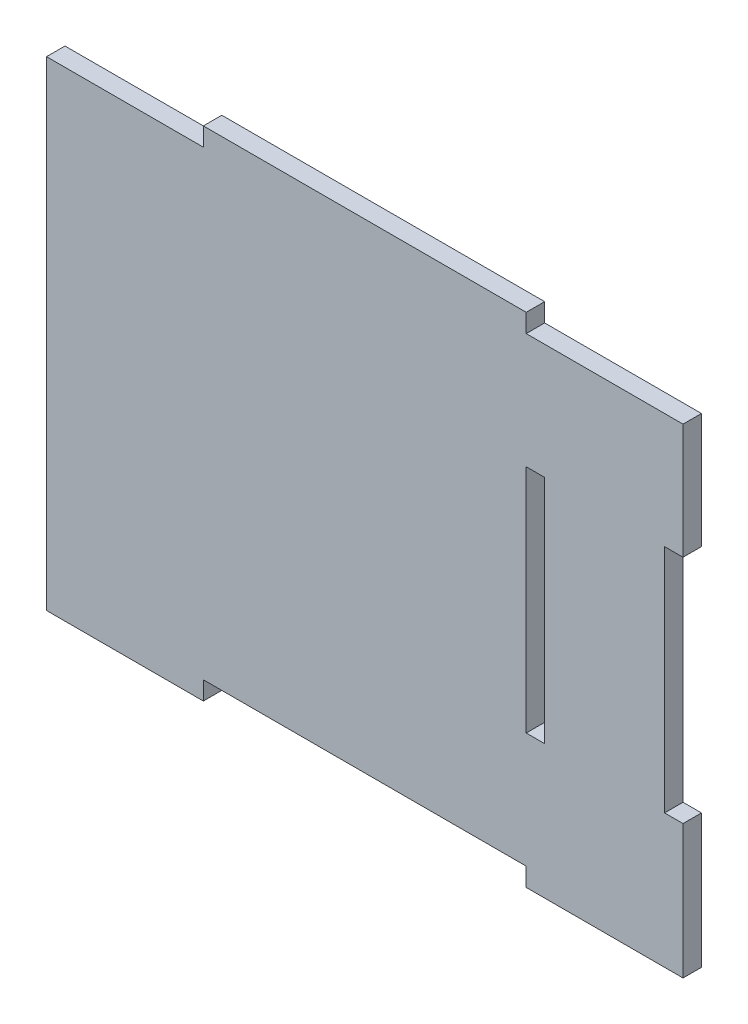
from build123d import *

# Parameters (mm, degrees)
SKETCH_1_W      = 4
SKETCH_1_H      = 50
EXTRUDE_1_DEPTH = 4


with BuildPart() as part:
    # Эскиз1 → Бобышка-Вытянуть1 (new body)
    with BuildSketch(Plane.XY):
        Polygon((-35.380363478, 50.607363696), (-65.380363478, 50.607363696), (-69.380363478, 50.607363696), (-69.380363478, -53.392636304), (-65.380363478, -53.392636304), (-35.380363478, -53.392636304), (-35.380363478, -49.392636304), (34.619636522, -49.392636304), (34.619636522, -53.392636304), (64.619636522, -53.392636304), (68.619636522, -53.392636304), (68.619636522, -24.392636304), (64.619636522, -24.392636304), (64.619636522, 25.607363696), (68.619636522, 25.607363696), (68.619636522, 50.607363696), (64.619636522, 50.607363696), (34.619636522, 50.607363696), (34.619636522, 54.607363696), (-35.380363478, 54.607363696), align=None)
        with Locations((36.619636522, 0.607363696)):
            Rectangle(SKETCH_1_W, SKETCH_1_H, mode=Mode.SUBTRACT)
    extrude(amount=EXTRUDE_1_DEPTH)


solid = part.part
